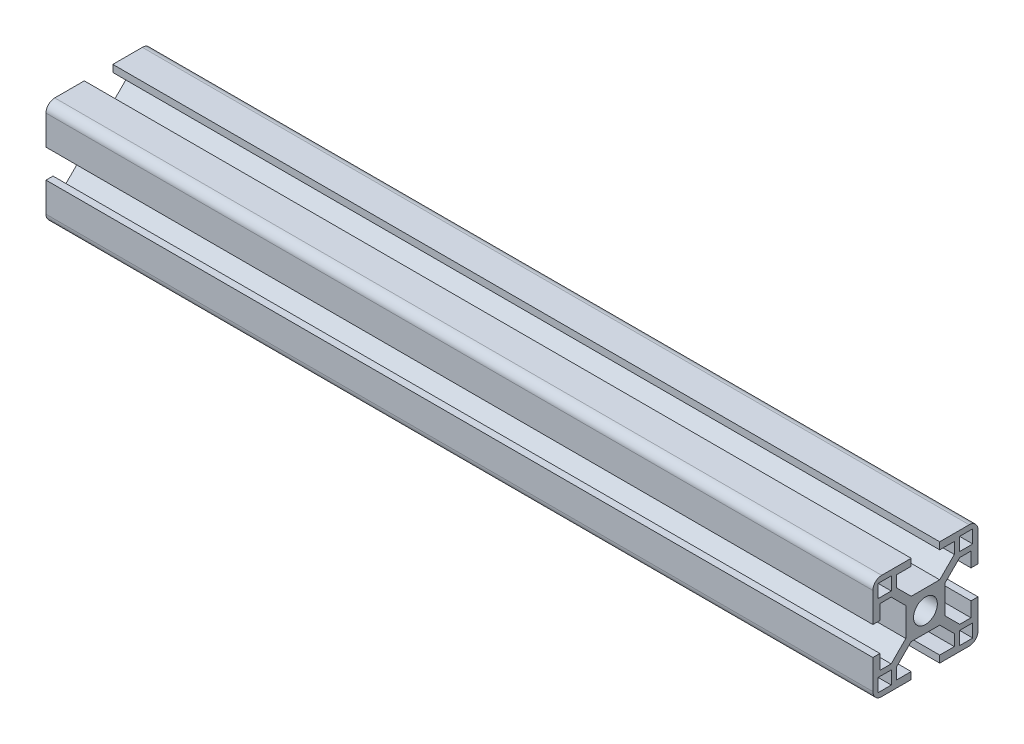
from build123d import *

# Parameters (mm, degrees)
SKETCH11_R                     = 3.4
SKETCH11_W                     = 3.75
SKETCH11_H                     = 3.75
T_SLOT_PROFILES_3030_2_1_DEPTH = 236


with BuildPart() as part:
    # Sketch11 → T-slot profiles 3030_2(1) (new body)
    with BuildSketch(Plane.YZ):
        with BuildLine():
            Line((-4.07, 5.6), (4.07, 5.6))
            Line((4.07, 5.6), (8.25, 9.78))
            Line((8.25, 9.78), (8.25, 13))
            Line((8.25, 13), (4.07, 13))
            Line((4.07, 13), (4.07, 15))
            Line((4.07, 15), (12.5, 15))
            ThreePointArc((12.5, 15), (14.267766953, 14.267766953), (15, 12.5))
            Line((15, 12.5), (15, 4.07))
            Line((15, 4.07), (13, 4.07))
            Line((13, 4.07), (13, 8.25))
            Line((13, 8.25), (9.78, 8.25))
            Line((9.78, 8.25), (5.6, 4.07))
            Line((5.6, 4.07), (5.6, -4.07))
            Line((5.6, -4.07), (9.78, -8.25))
            Line((9.78, -8.25), (13, -8.25))
            Line((13, -8.25), (13, -4.07))
            Line((13, -4.07), (15, -4.07))
            Line((15, -4.07), (15, -12.5))
            ThreePointArc((15, -12.5), (14.267766953, -14.267766953), (12.5, -15))
            Line((12.5, -15), (4.07, -15))
            Line((4.07, -15), (4.07, -13))
            Line((4.07, -13), (8.25, -13))
            Line((8.25, -13), (8.25, -9.78))
            Line((8.25, -9.78), (4.07, -5.6))
            Line((4.07, -5.6), (-4.07, -5.6))
            Line((-4.07, -5.6), (-8.25, -9.78))
            Line((-8.25, -9.78), (-8.25, -13))
            Line((-8.25, -13), (-4.07, -13))
            Line((-4.07, -13), (-4.07, -15))
            Line((-4.07, -15), (-12.5, -15))
            ThreePointArc((-12.5, -15), (-14.267766953, -14.267766953), (-15, -12.5))
            Line((-15, -12.5), (-15, -4.07))
            Line((-15, -4.07), (-13, -4.07))
            Line((-13, -4.07), (-13, -8.25))
            Line((-13, -8.25), (-9.78, -8.25))
            Line((-9.78, -8.25), (-5.6, -4.07))
            Line((-5.6, -4.07), (-5.6, 4.07))
            Line((-5.6, 4.07), (-9.78, 8.25))
            Line((-9.78, 8.25), (-13, 8.25))
            Line((-13, 8.25), (-13, 4.07))
            Line((-13, 4.07), (-15, 4.07))
            Line((-15, 4.07), (-15, 12.5))
            ThreePointArc((-15, 12.5), (-14.267766953, 14.267766953), (-12.5, 15))
            Line((-12.5, 15), (-4.07, 15))
            Line((-4.07, 15), (-4.07, 13))
            Line((-4.07, 13), (-8.25, 13))
            Line((-8.25, 13), (-8.25, 9.78))
            Line((-8.25, 9.78), (-4.07, 5.6))
        make_face()
        Circle(SKETCH11_R, mode=Mode.SUBTRACT)
        with Locations((11.625, 11.625)):
            Rectangle(SKETCH11_W, SKETCH11_H, mode=Mode.SUBTRACT)
        with Locations((11.625, -11.625)):
            Rectangle(SKETCH11_W, SKETCH11_H, mode=Mode.SUBTRACT)
        with Locations((-11.625, 11.625)):
            Rectangle(SKETCH11_W, SKETCH11_H, mode=Mode.SUBTRACT)
        with Locations((-11.625, -11.625)):
            Rectangle(SKETCH11_W, SKETCH11_H, mode=Mode.SUBTRACT)
    extrude(amount=T_SLOT_PROFILES_3030_2_1_DEPTH)


solid = part.part
